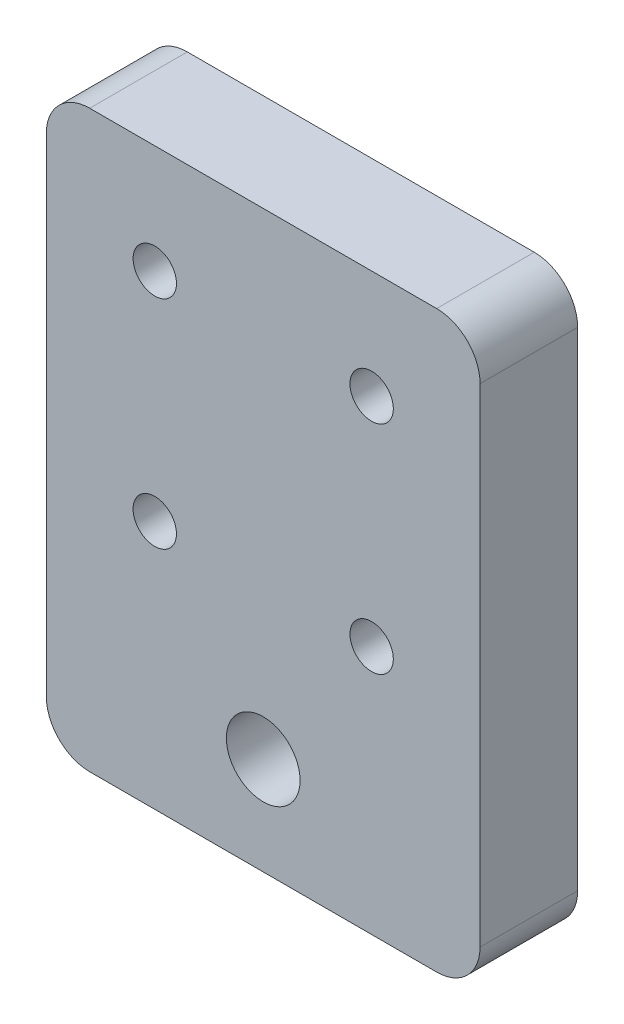
from build123d import *

# Parameters (mm, degrees)
ESQUISSE1_W             = 40
ESQUISSE1_H             = 53
BOSS_EXTRU_1_DEPTH      = 9
ESQUISSE2_R             = 2
ESQUISSE2_R_2           = 3.4
ENL_V_MAT_EXTRU_1_DEPTH = 68.007462271
CONG_1_R                = 4


with BuildPart() as part:
    # Esquisse1 → Boss.-Extru.1 (new body)
    with BuildSketch(Plane.XY):
        with Locations((20, 26.5)):
            Rectangle(ESQUISSE1_W, ESQUISSE1_H)
    extrude(amount=BOSS_EXTRU_1_DEPTH)

    # Esquisse2 → Enlèv. mat.-Extru.1 (cut, through all)
    with BuildSketch(Plane.XY.offset(9)):
        with Locations((10, 43)):
            Circle(ESQUISSE2_R)
        with Locations(Location((30, 43, 0), (0, 0, 180))):
            Circle(ESQUISSE2_R)
        with Locations((30, 23)):
            Circle(ESQUISSE2_R)
        with Locations(Location((10, 23, 0), (0, 0, 180))):
            Circle(ESQUISSE2_R)
        with Locations((20, 9)):
            Circle(ESQUISSE2_R_2)
    extrude(amount=-ENL_V_MAT_EXTRU_1_DEPTH, mode=Mode.SUBTRACT)

    # Congé1
    cong_1_edges = [part.edges().sort_by_distance(p)[0] for p in [
        (0, 53, 4.5),
        (40, 53, 4.5),
        (40, 0, 4.5),
        (0, 0, 4.5),
    ]]
    fillet(cong_1_edges, radius=CONG_1_R)


solid = part.part
